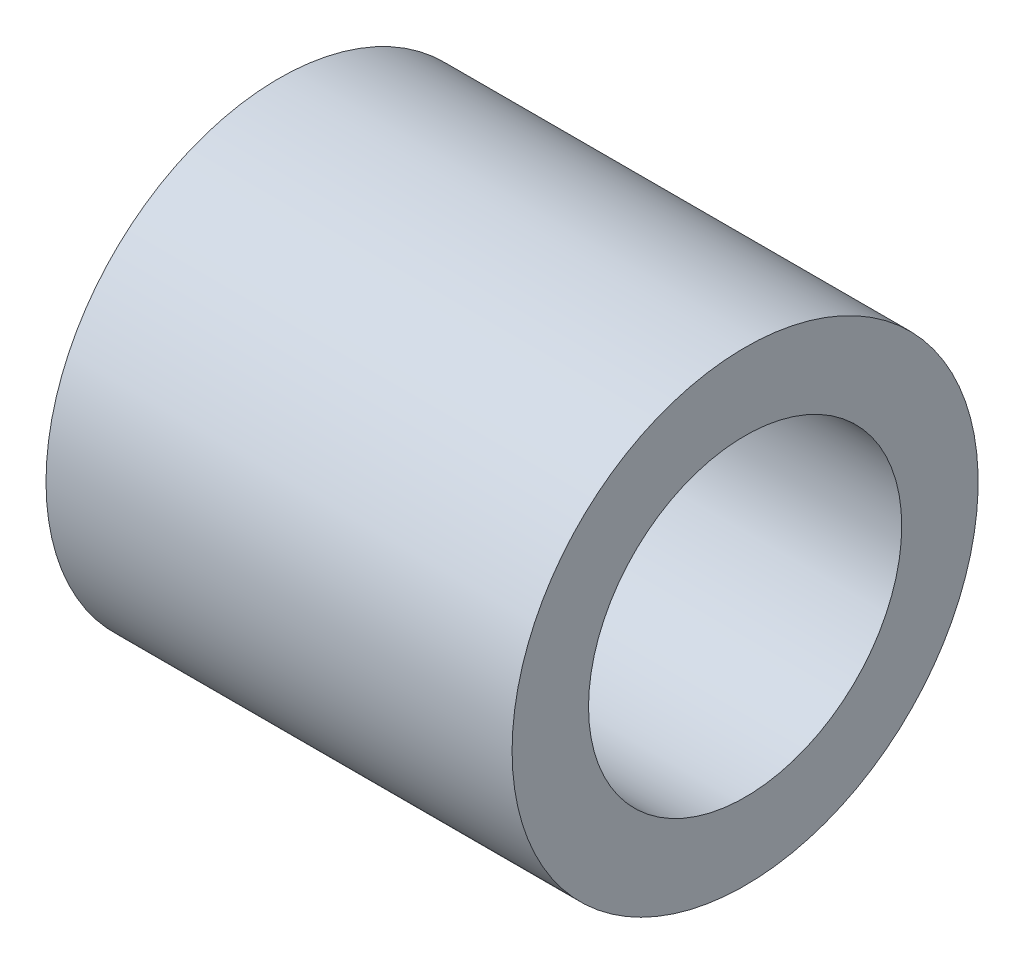
from build123d import *

# Parameters (mm, degrees)
SKETCH1_R           = 4.7625
BOSS_EXTRUDE1_DEPTH = 9.525
SKETCH2_R           = 3.2004
CUT_EXTRUDE1_DEPTH  = 9.525


with BuildPart() as part:
    # Sketch1 → Boss-Extrude1 (new body)
    with BuildSketch(Plane(origin=(0, 0, 0), x_dir=(0, 0, -1), z_dir=(1, 0, 0))):
        with Locations(Location((0, 0, 0), (0, 0, 180))):
            Circle(SKETCH1_R)
    extrude(amount=BOSS_EXTRUDE1_DEPTH)

    # Sketch2 → Cut-Extrude1 (cut)
    with BuildSketch(Plane.ZY):
        Circle(SKETCH2_R)
    extrude(amount=-CUT_EXTRUDE1_DEPTH, mode=Mode.SUBTRACT)


solid = part.part
